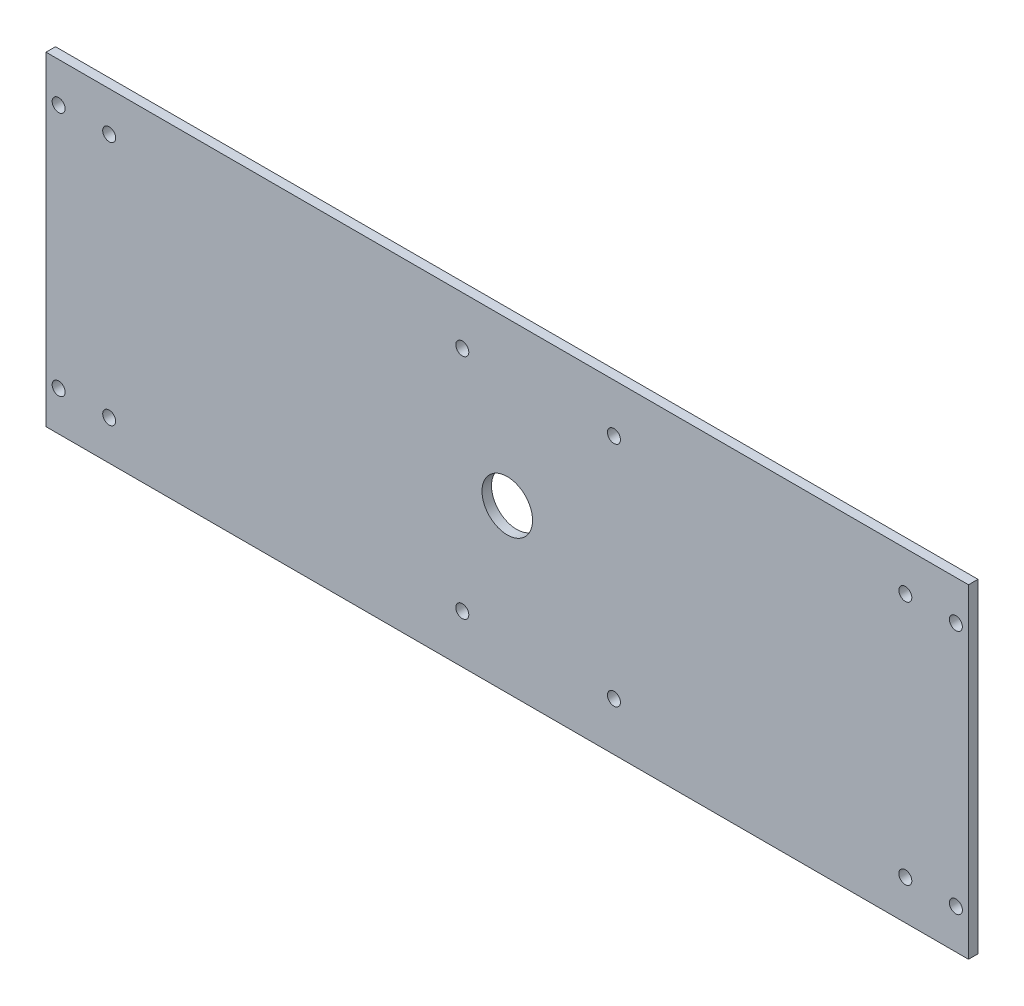
from build123d import *

# Parameters (mm, degrees)
SKETCH1_W                      = 231.775
SKETCH1_H                      = 81.4959
BOSS_EXTRUDE1_DEPTH            = 2.38125
F_4_CLEARANCE_HOLE1_D          = 3.2639
F_4_CLEARANCE_HOLE2_AT_2_COUNT = 2
F_4_CLEARANCE_HOLE2_AT_2_PITCH = 12.7
F_1_2_0_5_DIAMETER_HOLE1_D     = 12.7


with BuildPart() as part:
    # Sketch1 → Boss-Extrude1 (new body)
    with BuildSketch(Plane.XY):
        Rectangle(SKETCH1_W, SKETCH1_H)
    extrude(amount=BOSS_EXTRUDE1_DEPTH)

    # #4 Clearance Hole1 (through all)
    with Locations(Plane.XY.offset(2.38125)):
        with Locations((-11.29792, 28.575), (26.80208, 28.575)):
            f_4_clearance_hole1 = Hole(F_4_CLEARANCE_HOLE1_D / 2)

    # Mirror1: #4 Clearance Hole1 across plane
    add(f_4_clearance_hole1.mirror(Plane.ZX), mode=Mode.SUBTRACT)

    # Sketch6 → #4 Clearance Hole2 (revolve, cut)
    with BuildSketch(Plane(origin=(-112.7125, 30.82036, 2.38125), x_dir=(0, -1, 0), z_dir=(1, 0, 0))):
        Polygon((0, 0), (0, 10.505574487), (1.63195, 9.525), (1.63195, 0), align=None)
    f_4_clearance_hole2 = revolve(axis=Axis((-112.7125, 30.82036, 8.73125), (0, 0, -1)), mode=Mode.SUBTRACT)

    # #4 Clearance Hole2 at 2: #4 Clearance Hole2 ×2
    with Locations(*[(i * F_4_CLEARANCE_HOLE2_AT_2_PITCH, 0, 0) for i in range(1, F_4_CLEARANCE_HOLE2_AT_2_COUNT)]):
        add(f_4_clearance_hole2, mode=Mode.SUBTRACT)

    # Mirror2: #4 Clearance Hole2 across plane
    add(f_4_clearance_hole2.mirror(Plane(origin=(0, 0, 0), x_dir=(0, 0, 1), z_dir=(1, 0, 0))), mode=Mode.SUBTRACT)

    # Mirror2 copy 1 sketch → Mirror2 copy 1 (revolve, cut)
    with BuildSketch(Plane(origin=(100.0125, 30.82036, 2.38125), x_dir=(0, -1, 0), z_dir=(-1, 0, 0))):
        Polygon((0, 0), (0, -10.505574487), (1.63195, -9.525), (1.63195, 0), align=None)
    revolve(axis=Axis((100.0125, 30.82036, 8.73125), (0, 0, 1)), mode=Mode.SUBTRACT)

    # Mirror3: #4 Clearance Hole2 across plane
    add(f_4_clearance_hole2.mirror(Plane.ZX), mode=Mode.SUBTRACT)

    # Mirror3 copy 1 sketch → Mirror3 copy 1 (revolve, cut)
    with BuildSketch(Plane(origin=(-100.0125, -30.82036, 2.38125), x_dir=(0, 1, 0), z_dir=(1, 0, 0))):
        Polygon((0, 0), (0, -10.505574487), (1.63195, -9.525), (1.63195, 0), align=None)
    revolve(axis=Axis((-100.0125, -30.82036, 8.73125), (0, 0, 1)), mode=Mode.SUBTRACT)

    # Mirror3 copy 2 sketch → Mirror3 copy 2 (revolve, cut)
    with BuildSketch(Plane(origin=(112.7125, -30.82036, 2.38125), x_dir=(0, 1, 0), z_dir=(-1, 0, 0))):
        Polygon((0, 0), (0, 10.505574487), (1.63195, 9.525), (1.63195, 0), align=None)
    revolve(axis=Axis((112.7125, -30.82036, 8.73125), (0, 0, -1)), mode=Mode.SUBTRACT)

    # Mirror3 copy 3 sketch → Mirror3 copy 3 (revolve, cut)
    with BuildSketch(Plane(origin=(100.0125, -30.82036, 2.38125), x_dir=(0, 1, 0), z_dir=(-1, 0, 0))):
        Polygon((0, 0), (0, 10.505574487), (1.63195, 9.525), (1.63195, 0), align=None)
    revolve(axis=Axis((100.0125, -30.82036, 8.73125), (0, 0, -1)), mode=Mode.SUBTRACT)

    # 1/2 (0.5) Diameter Hole1 (through all)
    with Locations(Plane.XY.offset(2.38125)):
        with Locations((0, 0)):
            Hole(F_1_2_0_5_DIAMETER_HOLE1_D / 2)


solid = part.part
